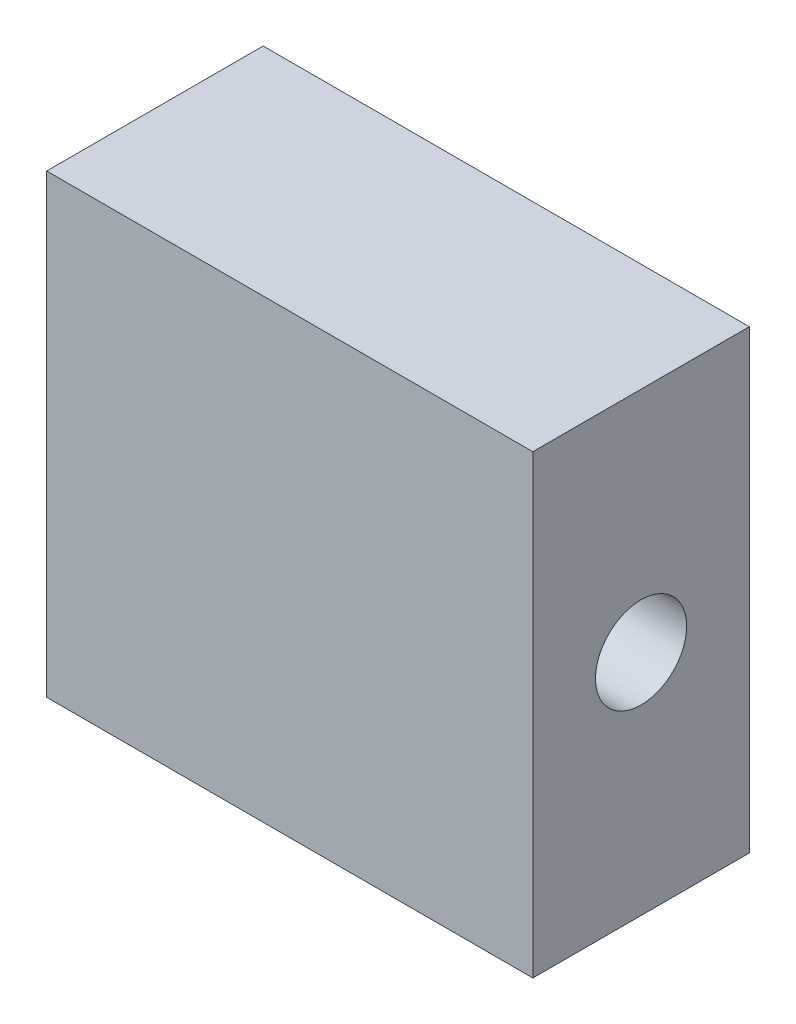
from build123d import *

# Parameters (mm, degrees)
SKETCH1_W                 = 32
SKETCH1_H                 = 30
BOSS_EXTRUDE1_DEPTH       = 7.125
M3X0_5_TAPPED_HOLE1_D     = 2.5
M3X0_5_TAPPED_HOLE1_DEPTH = 7.5
M3X0_5_TAPPED_HOLE1_TIP   = 0.751075774
M6X1_0_TAPPED_HOLE1_D     = 6


with BuildPart() as part:
    # Sketch1 → Boss-Extrude1 (new, symmetric)
    with BuildSketch(Plane.XY):
        Rectangle(SKETCH1_W, SKETCH1_H)
    extrude(amount=BOSS_EXTRUDE1_DEPTH, both=True)

    # M3x0.5 Tapped Hole1
    with Locations(Plane(origin=(0, 0, -7.125), x_dir=(-1, 0, 0), z_dir=(0, 0, -1))):
        with Locations((-9.333333333, 10), (10.666666667, 10), (10.666666667, -10), (-9.333333333, -10)):
            Hole(M3X0_5_TAPPED_HOLE1_D / 2, depth=M3X0_5_TAPPED_HOLE1_DEPTH)
            with Locations((0, 0, -(M3X0_5_TAPPED_HOLE1_DEPTH + M3X0_5_TAPPED_HOLE1_TIP / 2))):  # 118° drill point
                Cone(0, M3X0_5_TAPPED_HOLE1_D / 2, M3X0_5_TAPPED_HOLE1_TIP, mode=Mode.SUBTRACT)

    # M6x1.0 Tapped Hole1 (through all)
    with Locations(Plane(origin=(16, 0, 0), x_dir=(0, 0, -1), z_dir=(1, 0, 0))):
        with Locations((0, 0)):
            Hole(M6X1_0_TAPPED_HOLE1_D / 2)


solid = part.part
